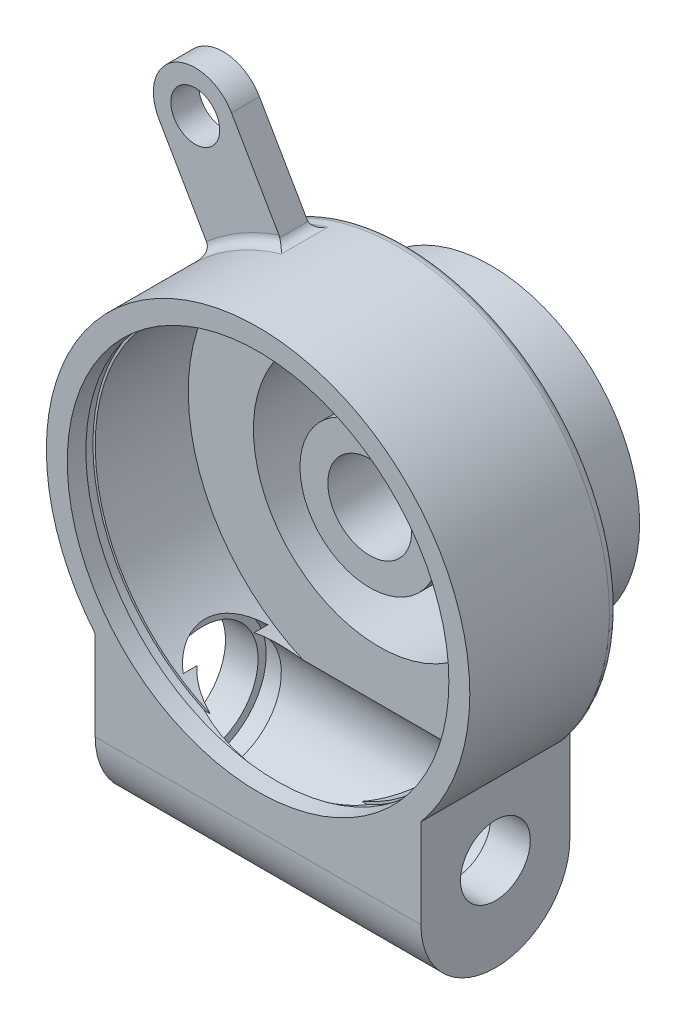
from build123d import *

# Parameters (mm, degrees)
SKETCH_1_R              = 45.5
EXTRUDE_1_DEPTH         = 32
SKETCH_2_R              = 32
EXTRUDE_2_DEPTH         = 18
EXTRUDE_START           = -26
EXTRUDE_3_DEPTH         = 6
SKETCH_4_R              = 5.25
CUT_EXTRUDE_1_DEPTH     = 87.38533809
EXTRUDE_4_DEPTH         = 35
SKETCH_6_R              = 41
CUT_EXTRUDE_2_DEPTH     = 26
CUT_EXTRUDE_START       = -6
SKETCH_7_R              = 41.5
CUT_EXTRUDE_3_DEPTH     = 2
CUT_EXTRUDE_4_REACH     = 102.197
CUT_EXTRUDE_START_2     = 5
SKETCH_8_R              = 27
EXTRUDE_START_2         = -5
SKETCH_9_R              = 15
EXTRUDE_5_DEPTH         = 26
CUT_EXTRUDE_5_REACH     = 97.197
SKETCH_10_R             = 9
CHAMFER_1_SIZE          = 1
CUT_EXTRUDE_START_3     = -12
SKETCH_11_R             = 13.75
CUT_EXTRUDE_6_DEPTH     = 5
HOLE_WIZARD_M27_1_D     = 24
HOLE_WIZARD_M27_1_DEPTH = 7
CUT_EXTRUDE_START_4     = -49.5
SKETCH_14_R             = 12
CUT_EXTRUDE_7_DEPTH     = 49.5
CUT_EXTRUDE_8_REACH     = 112.346
SKETCH_15_R             = 7.5
FILLET_1_R              = 2
FILLET_2_R              = 2
FILLET_3_R              = 2


with BuildPart() as part:
    # 草图1 → 凸台-拉伸1 (new body)
    with BuildSketch(Plane.XY):
        Circle(SKETCH_1_R)
    extrude(amount=-EXTRUDE_1_DEPTH)

    # 草图2 → 凸台-拉伸2 (add)
    with BuildSketch(Plane(origin=(0, 0, -32), x_dir=(-1, 0, 0), z_dir=(0, 0, -1))):
        Circle(SKETCH_2_R)
    extrude(amount=EXTRUDE_2_DEPTH)

    # 草图3 → 凸台-拉伸3 (add)
    with BuildSketch(Plane.XY.offset(EXTRUDE_START)):
        with BuildLine():
            Line((-7.794228634, -4.5), (-41.294228634, 53.523702054))
            ThreePointArc((-41.294228634, 53.523702054), (-38, 65.817930688), (-25.705771366, 62.523702054))
            Line((-25.705771366, 62.523702054), (7.794228634, 4.5))
            ThreePointArc((7.794228634, 4.5), (4.5, -7.794228634), (-7.794228634, -4.5))
        make_face()
    extrude(amount=EXTRUDE_3_DEPTH)

    # 草图4 → 切除-拉伸1 (cut, through all)
    with BuildSketch(Plane.XY.offset(-20)):
        with Locations((-33.5, 58.023702054)):
            Circle(SKETCH_4_R)
    extrude(amount=-CUT_EXTRUDE_1_DEPTH, mode=Mode.SUBTRACT)

    # 草图5 → 凸台-拉伸4 (add, symmetric)
    with BuildSketch(Plane(origin=(0, 0, 0), x_dir=(0, 0, -1), z_dir=(1, 0, 0))):
        with BuildLine():
            Line((32, -48.25), (32, -0.188756435))
            Line((32, -0.188756435), (0, -0.188756435))
            Line((0, -0.188756435), (0, -48.25))
            ThreePointArc((0, -48.25), (16, -64.25), (32, -48.25))
        make_face()
    extrude(amount=EXTRUDE_4_DEPTH, both=True)

    # 草图6 → 切除-拉伸2 (cut)
    with BuildSketch(Plane.XY):
        Circle(SKETCH_6_R)
    extrude(amount=-CUT_EXTRUDE_2_DEPTH, mode=Mode.SUBTRACT)

    # 草图7 → 切除-拉伸3 (cut)
    with BuildSketch(Plane.XY.offset(CUT_EXTRUDE_START)):
        Circle(SKETCH_7_R)
    extrude(amount=CUT_EXTRUDE_3_DEPTH, mode=Mode.SUBTRACT)

    # 草图8 → 切除-拉伸4 (cut, up to next)
    with BuildSketch(Plane.XY.offset(-50).offset(CUT_EXTRUDE_START_2), mode=Mode.PRIVATE) as cut_extrude_4_sk1:
        Circle(SKETCH_8_R)
    cut_extrude_4_tool1 = extrude(cut_extrude_4_sk1.sketch, amount=CUT_EXTRUDE_4_REACH, mode=Mode.PRIVATE) & part.part
    add(cut_extrude_4_tool1.solids().sort_by_distance((0, 0, -45))[0], mode=Mode.SUBTRACT)

    # 草图9 → 凸台-拉伸5 (add)
    with BuildSketch(Plane.XY.offset(-45).offset(EXTRUDE_START_2)):
        with Locations(Location((0, 0, 0), (0, 0, 180))):
            Circle(SKETCH_9_R)
    extrude(amount=EXTRUDE_5_DEPTH)

    # 草图10 → 切除-拉伸5 (cut, up to next)
    with BuildSketch(Plane(origin=(0, 0, -50), x_dir=(-1, 0, 0), z_dir=(0, 0, -1)), mode=Mode.PRIVATE) as cut_extrude_5_sk1:
        Circle(SKETCH_10_R)
    cut_extrude_5_tool1 = extrude(cut_extrude_5_sk1.sketch, amount=-CUT_EXTRUDE_5_REACH, mode=Mode.PRIVATE) & part.part
    add(cut_extrude_5_tool1.solids().sort_by_distance((0, 0, -50))[0], mode=Mode.SUBTRACT)

    # 倒角1
    chamfer_1_edges = [part.edges().sort_by_distance(p)[0] for p in [
        (9, 0, -50),
    ]]
    chamfer(chamfer_1_edges, length=CHAMFER_1_SIZE)

    # 草图11 → 切除-拉伸6 (cut)
    with BuildSketch(Plane.ZY.offset(35).offset(CUT_EXTRUDE_START_3)):
        with Locations(Location((-16, -44.25, 0), (0, 0, 131.432457074))):
            Circle(SKETCH_11_R)
    extrude(amount=CUT_EXTRUDE_6_DEPTH, mode=Mode.SUBTRACT)

    # M27 螺纹孔1
    with Locations(Plane.ZY.offset(35)):
        with Locations((-16, -44.25)):
            Hole(HOLE_WIZARD_M27_1_D / 2, depth=HOLE_WIZARD_M27_1_DEPTH)

    # 草图14 → 切除-拉伸7 (cut)
    with BuildSketch(Plane.ZY.offset(23).offset(CUT_EXTRUDE_START_4)):
        with Locations((-16, -44.25)):
            Circle(SKETCH_14_R)
    extrude(amount=CUT_EXTRUDE_7_DEPTH, mode=Mode.SUBTRACT)

    # 草图15 → 切除-拉伸8 (cut, up to next)
    with BuildSketch(Plane.ZY.offset(-26.5), mode=Mode.PRIVATE) as cut_extrude_8_sk1:
        with Locations((-16, -44.25)):
            Circle(SKETCH_15_R)
    cut_extrude_8_tool1 = extrude(cut_extrude_8_sk1.sketch, amount=-CUT_EXTRUDE_8_REACH, mode=Mode.PRIVATE) & part.part
    add(cut_extrude_8_tool1.solids().sort_by_distance((26.5, -44.25, -16))[0], mode=Mode.SUBTRACT)

    # 圆角1
    fillet_1_edges = [part.edges().sort_by_distance(p)[0] for p in [
        (-14.506275845, 43.125606791, -23),
        (-22.75, 39.404155872, -20),
        (-30.094733113, 34.125606791, -23),
        (-22.75, 39.404155872, -26),
    ]]
    fillet(fillet_1_edges, radius=FILLET_1_R)

    # 圆角2
    fillet_2_edges = [part.edges().sort_by_distance(p)[0] for p in [
        (-15.455581516, 42.794567412, -32),
        (32.000000002, 0, -32),
    ]]
    fillet(fillet_2_edges, radius=FILLET_2_R)

    # 圆角3
    fillet_3_edges = [part.edges().sort_by_distance(p)[0] for p in [
        (-27, 0, -45),
        (15, 0, -45),
    ]]
    fillet(fillet_3_edges, radius=FILLET_3_R)


solid = part.part
